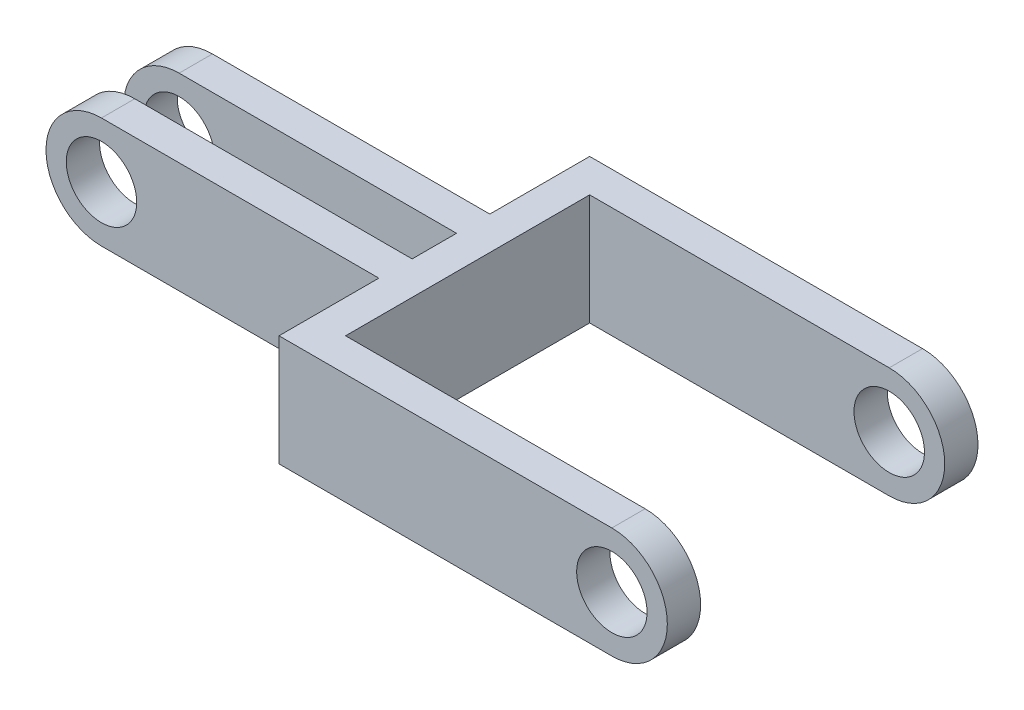
from build123d import *

# Parameters (mm, degrees)
SKETCH1_R           = 3.175
BOSS_EXTRUDE1_DEPTH = 3
SKETCH2_W           = 9
SKETCH2_H           = 10
BOSS_EXTRUDE2_DEPTH = 3
SKETCH3_W           = 30
SKETCH3_H           = 10
BOSS_EXTRUDE3_DEPTH = 3
BOSS_EXTRUDE4_DEPTH = 3
SKETCH6_R           = 3.175
CUT_EXTRUDE1_DEPTH  = 3
SKETCH7_W           = 3
SKETCH7_H           = 8
BOSS_EXTRUDE5_DEPTH = 10


with BuildPart() as part:
    # Sketch1 → Boss-Extrude1 (new body)
    with BuildSketch(Plane.XY):
        with BuildLine():
            Line((0, 0), (25, 0))
            Line((25, 0), (25, 10))
            Line((25, 10), (0, 10))
            ThreePointArc((0, 10), (-5, 5), (0, 0))
        make_face()
        with Locations((0, 5)):
            Circle(SKETCH1_R, mode=Mode.SUBTRACT)
    boss_extrude1 = extrude(amount=BOSS_EXTRUDE1_DEPTH)

    # Sketch2 → Boss-Extrude2 (add)
    with BuildSketch(Plane(origin=(25, 0, 0), x_dir=(0, 0, -1), z_dir=(1, 0, 0))):
        with Locations((1.5, 5)):
            Rectangle(SKETCH2_W, SKETCH2_H)
    boss_extrude2 = extrude(amount=BOSS_EXTRUDE2_DEPTH)

    # Sketch3 → Boss-Extrude3 (add)
    with BuildSketch(Plane(origin=(0, 0, -6), x_dir=(-1, 0, 0), z_dir=(0, 0, -1))):
        with Locations((-40, 5)):
            Rectangle(SKETCH3_W, SKETCH3_H)
    boss_extrude3 = extrude(amount=BOSS_EXTRUDE3_DEPTH)

    # Sketch5 → Boss-Extrude4 (add)
    with BuildSketch(Plane(origin=(0, 0, -9), x_dir=(-1, 0, 0), z_dir=(0, 0, -1))):
        with BuildLine():
            Line((-55, 10), (-55, 0))
            ThreePointArc((-55, 0), (-60, 5), (-55, 10))
        make_face()
    boss_extrude4 = extrude(amount=-BOSS_EXTRUDE4_DEPTH)

    # Sketch6 → Cut-Extrude1 (cut)
    with BuildSketch(Plane(origin=(0, 0, -9), x_dir=(-1, 0, 0), z_dir=(0, 0, -1))):
        with Locations((-55, 5)):
            Circle(SKETCH6_R)
    cut_extrude1 = extrude(amount=-CUT_EXTRUDE1_DEPTH, mode=Mode.SUBTRACT)

    # Sketch7 → Boss-Extrude5 (add)
    with BuildSketch(Plane(origin=(0, 10, 0), x_dir=(1, 0, 0), z_dir=(0, 1, 0))):
        with Locations((26.5, -7)):
            Rectangle(SKETCH7_W, SKETCH7_H)
    boss_extrude5 = extrude(amount=-BOSS_EXTRUDE5_DEPTH)

    # Mirror5: Boss-Extrude1, Boss-Extrude2, Boss-Extrude3, Boss-Extrude4, Cut-Extrude1, Boss-Extrude5 across plane
    add(boss_extrude1.mirror(Plane.XY.offset(5)))
    add(boss_extrude2.mirror(Plane.XY.offset(5)))
    add(boss_extrude3.mirror(Plane.XY.offset(5)))
    add(boss_extrude4.mirror(Plane.XY.offset(5)))
    add(cut_extrude1.mirror(Plane.XY.offset(5)), mode=Mode.SUBTRACT)
    add(boss_extrude5.mirror(Plane.XY.offset(5)))


solid = part.part
